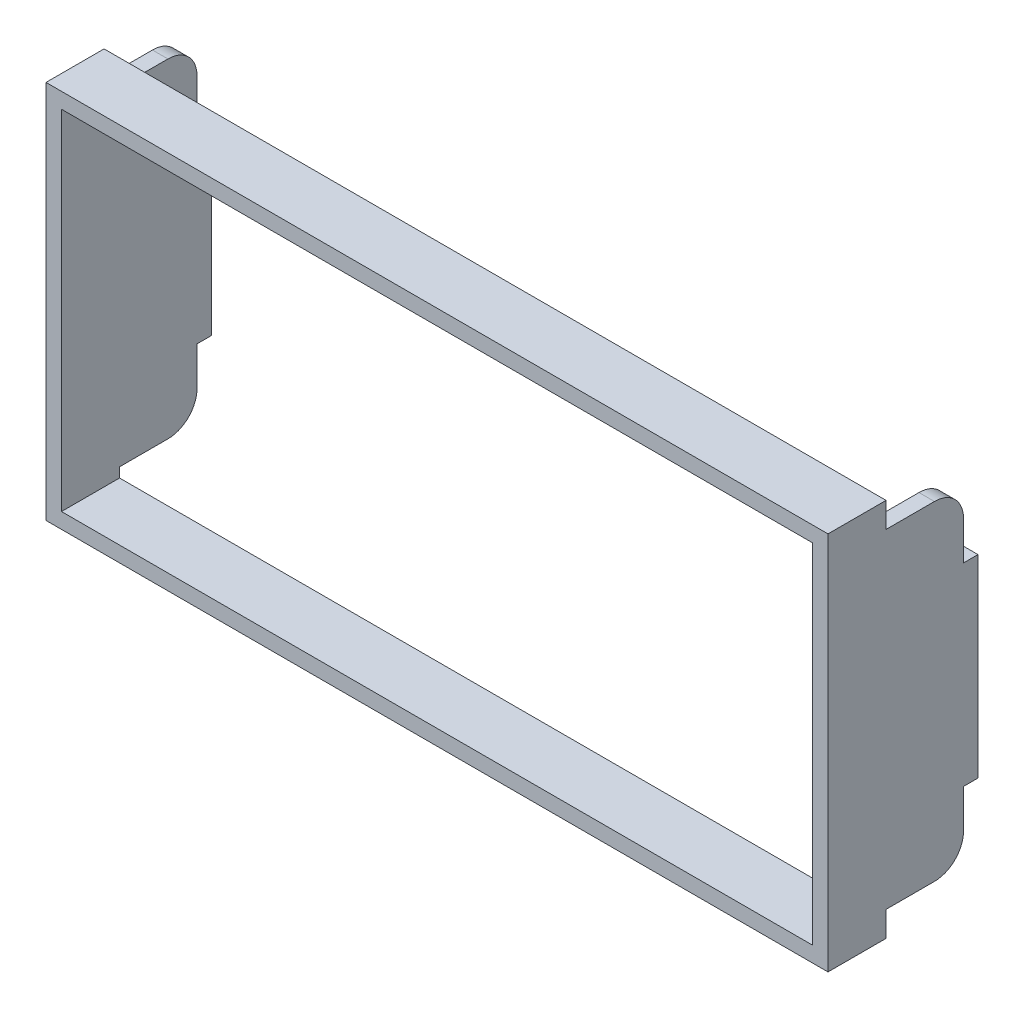
from build123d import *

# Parameters (mm, degrees)
SKETCH1_W           = 80.8
SKETCH1_H           = 39.2
SKETCH1_W_2         = 77.6
SKETCH1_H_2         = 36
BOSS_EXTRUDE1_DEPTH = 6
SKETCH2_W           = 1.6
SKETCH2_H           = 36
BOSS_EXTRUDE2_DEPTH = 8
MOVE_FACE1_BY       = 1
MOVE_FACE1_2_BY     = 1
MOVE_FACE1_3_BY     = 1
MOVE_FACE1_4_BY     = 1
SKETCH3_W           = 1.6
SKETCH3_H           = 20
BOSS_EXTRUDE3_DEPTH = 2
CHAMFER1_SIZE       = 0.5
FILLET1_R           = 3


with BuildPart() as part:
    # Sketch1 → Boss-Extrude1 (new body)
    with BuildSketch(Plane.XY):
        with Locations((38.8, -18)):
            Rectangle(SKETCH1_W, SKETCH1_H)
        with Locations((38.8, -18)):
            Rectangle(SKETCH1_W_2, SKETCH1_H_2, mode=Mode.SUBTRACT)
    extrude(amount=BOSS_EXTRUDE1_DEPTH)

    # Sketch2 → Boss-Extrude2 (add)
    with BuildSketch(Plane(origin=(0, 0, 0), x_dir=(-1, 0, 0), z_dir=(0, 0, -1))):
        with Locations((-78.4, -18)):
            Rectangle(SKETCH2_W, SKETCH2_H)
        with Locations((0.8, -18)):
            Rectangle(SKETCH2_W, SKETCH2_H)
    extrude(amount=BOSS_EXTRUDE2_DEPTH)

    # Move Face1: a face moved inward by 1.0
    extrude(part.faces().sort_by_distance((78.4, 0, -4))[0], amount=MOVE_FACE1_BY, dir=(0, -1, 0), mode=Mode.SUBTRACT)

    # Move Face1 2: a face moved inward by 1.0
    extrude(part.faces().sort_by_distance((78.4, -36, -4))[0], amount=MOVE_FACE1_2_BY, dir=(0, 1, 0), mode=Mode.SUBTRACT)

    # Move Face1 3: a face moved inward by 1.0
    extrude(part.faces().sort_by_distance((-0.8, -36, -4))[0], amount=MOVE_FACE1_3_BY, dir=(0, 1, 0), mode=Mode.SUBTRACT)

    # Move Face1 4: a face moved inward by 1.0
    extrude(part.faces().sort_by_distance((-0.8, 0, -4))[0], amount=MOVE_FACE1_4_BY, dir=(0, -1, 0), mode=Mode.SUBTRACT)

    # Sketch3 → Boss-Extrude3 (add)
    with BuildSketch(Plane(origin=(0, 0, -8), x_dir=(-1, 0, 0), z_dir=(0, 0, -1))):
        with Locations((-78.4, -18)):
            Rectangle(SKETCH3_W, SKETCH3_H)
        with Locations((0.8, -18)):
            Rectangle(SKETCH3_W, SKETCH3_H)
    extrude(amount=BOSS_EXTRUDE3_DEPTH)

    # Chamfer1
    chamfer1_edges = [part.edges().sort_by_distance(p)[0] for p in [
        (78.4, -28, -10),
        (77.6, -18, -10),
        (78.4, -8, -10),
        (79.2, -18, -10),
        (0, -18, -10),
        (-0.8, -28, -10),
        (-1.6, -18, -10),
        (-0.8, -8, -10),
    ]]
    chamfer(chamfer1_edges, length=CHAMFER1_SIZE)

    # Fillet1
    fillet1_edges = [part.edges().sort_by_distance(p)[0] for p in [
        (78.4, -1, -8),
        (78.4, -35, -8),
        (-0.8, -1, -8),
        (-0.8, -35, -8),
    ]]
    fillet(fillet1_edges, radius=FILLET1_R)


solid = part.part
